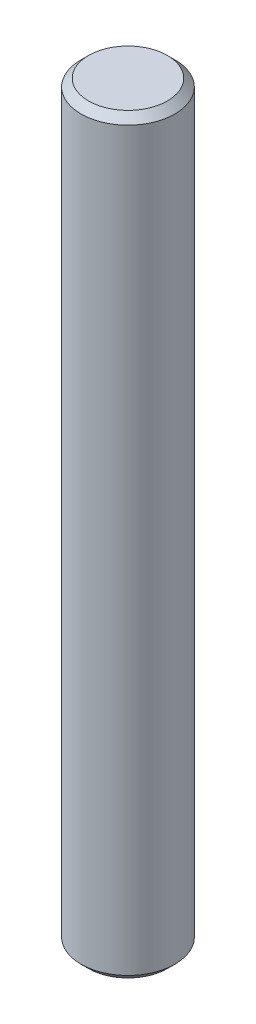
from build123d import *

# Parameters (mm, degrees)
IZIM1_R                     = 12.5
Y_KSEKLIK_EKSTR_ZYON1_DEPTH = 200
PAH1_SIZE                   = 2


with BuildPart() as part:
    # Çizim1 → Yükseklik-Ekstrüzyon1 (new body)
    with BuildSketch(Plane(origin=(0, 0, 0), x_dir=(1, 0, 0), z_dir=(0, 1, 0))):
        with Locations(Location((0, 0, 0), (0, 0, 270))):
            Circle(IZIM1_R)
    extrude(amount=Y_KSEKLIK_EKSTR_ZYON1_DEPTH)

    # Pah1
    pah1_edges = [part.edges().sort_by_distance(p)[0] for p in [
        (0, 0, -12.5),
        (0, 200, -12.5),
    ]]
    chamfer(pah1_edges, length=PAH1_SIZE)


solid = part.part
